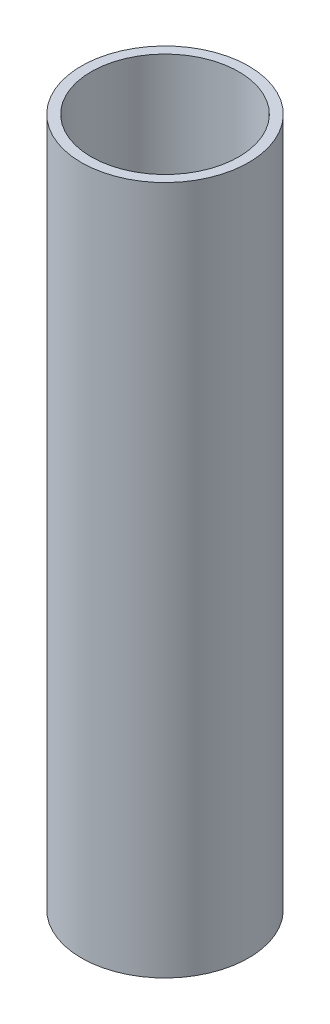
from build123d import *

# Parameters (mm, degrees)
SKETCH1_R           = 8.5
SKETCH1_R_2         = 7.5
BOSS_EXTRUDE1_DEPTH = 70


with BuildPart() as part:
    # Sketch1 → Boss-Extrude1 (new body)
    with BuildSketch(Plane(origin=(0, 0, 0), x_dir=(1, 0, 0), z_dir=(0, 1, 0))):
        with Locations(Location((0, 0, 0), (0, 0, 270))):
            Circle(SKETCH1_R)
        with Locations(Location((0, 0, 0), (0, 0, 270))):
            Circle(SKETCH1_R_2, mode=Mode.SUBTRACT)
    extrude(amount=BOSS_EXTRUDE1_DEPTH)


solid = part.part
